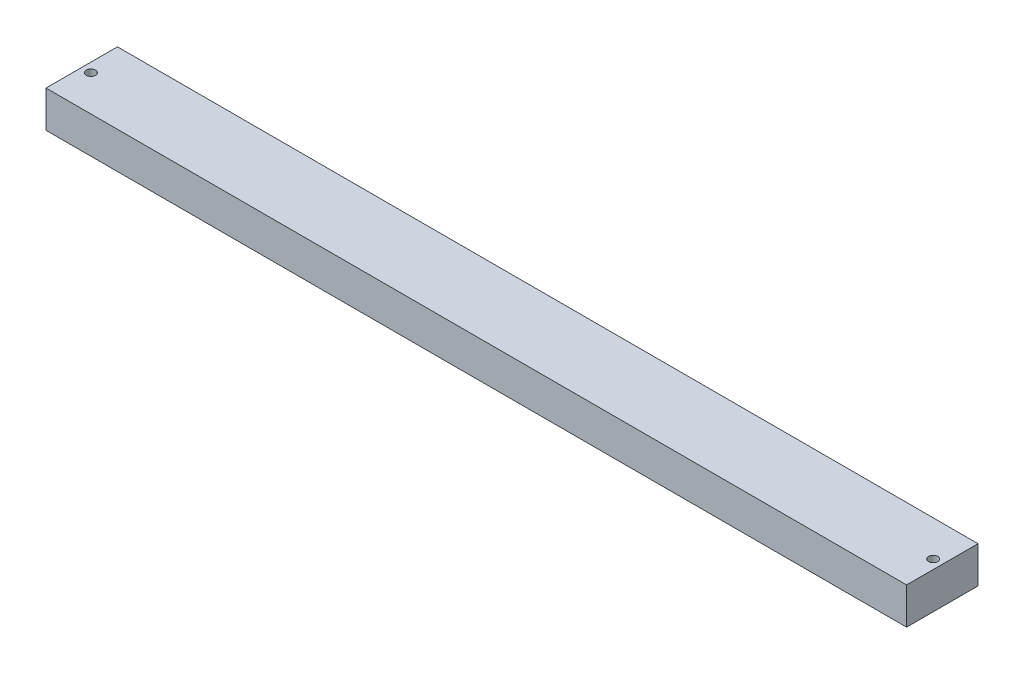
from build123d import *

# Parameters (mm, degrees)
SKETCH1_W           = 470
SKETCH1_H           = 20
BOSS_EXTRUDE1_DEPTH = 19.5
SKETCH2_R           = 10
CUT_EXTRUDE1_DEPTH  = 28
LPATTERN1_COUNT     = 8
LPATTERN1_PITCH     = 50
SKETCH3_R           = 2.5
CUT_EXTRUDE2_DEPTH  = 42
SKETCH4_R           = 10
BOSS_EXTRUDE2_DEPTH = 4.8
SKETCH5_R           = 1.5
CUT_EXTRUDE3_DEPTH  = 10


with BuildPart() as part:
    # Sketch1 → Boss-Extrude1 (new, symmetric)
    with BuildSketch(Plane.XY):
        Rectangle(SKETCH1_W, SKETCH1_H)
    extrude(amount=BOSS_EXTRUDE1_DEPTH, both=True)

    # Sketch2 → Cut-Extrude1 (cut)
    with BuildSketch(Plane(origin=(0, 10, 0), x_dir=(1, 0, 0), z_dir=(0, 1, 0))):
        with Locations(Location((-175, 0, 0), (0, 0, 180))):
            Circle(SKETCH2_R)
    cut_extrude1 = extrude(amount=-CUT_EXTRUDE1_DEPTH, mode=Mode.SUBTRACT)

    # LPattern1: Cut-Extrude1 ×8
    with Locations(*[(i * LPATTERN1_PITCH, 0, 0) for i in range(1, LPATTERN1_COUNT)]):
        add(cut_extrude1, mode=Mode.SUBTRACT)

    # Sketch3 → Cut-Extrude2 (cut)
    with BuildSketch(Plane(origin=(0, 10, 0), x_dir=(1, 0, 0), z_dir=(0, 1, 0))):
        with Locations(Location((230, 0, 0), (0, 0, 180))):
            Circle(SKETCH3_R)
    cut_extrude2 = extrude(amount=-CUT_EXTRUDE2_DEPTH, mode=Mode.SUBTRACT)

    # Mirror1: Cut-Extrude2 across plane
    add(cut_extrude2.mirror(Plane(origin=(0, 0, 0), x_dir=(0, 0, 1), z_dir=(1, 0, 0))), mode=Mode.SUBTRACT)

    # Sketch4 → Boss-Extrude2 (add)
    with BuildSketch(Plane(origin=(0, 10, 0), x_dir=(1, 0, 0), z_dir=(0, 1, 0))):
        with Locations(Location((-175, 0, 0), (0, 0, 180))):
            Circle(SKETCH4_R)
        with Locations(Location((-125, 0, 0), (0, 0, 180))):
            Circle(SKETCH4_R)
        with Locations(Location((-75, 0, 0), (0, 0, 180))):
            Circle(SKETCH4_R)
        with Locations(Location((-25, 0, 0), (0, 0, 180))):
            Circle(SKETCH4_R)
        with Locations(Location((25, 0, 0), (0, 0, 180))):
            Circle(SKETCH4_R)
        with Locations(Location((75, 0, 0), (0, 0, 180))):
            Circle(SKETCH4_R)
        with Locations(Location((125, 0, 0), (0, 0, 180))):
            Circle(SKETCH4_R)
        with Locations(Location((175, 0, 0), (0, 0, 180))):
            Circle(SKETCH4_R)
    extrude(amount=-BOSS_EXTRUDE2_DEPTH)

    # Sketch5 → Cut-Extrude3 (cut)
    with BuildSketch(Plane.ZY.offset(235)):
        with Locations((-12.5, 6)):
            Circle(SKETCH5_R)
        with Locations((-12.5, -6)):
            Circle(SKETCH5_R)
        with Locations((9.5, 6)):
            Circle(SKETCH5_R)
        with Locations((9.5, -6)):
            Circle(SKETCH5_R)
    extrude(amount=-CUT_EXTRUDE3_DEPTH, mode=Mode.SUBTRACT)


solid = part.part
